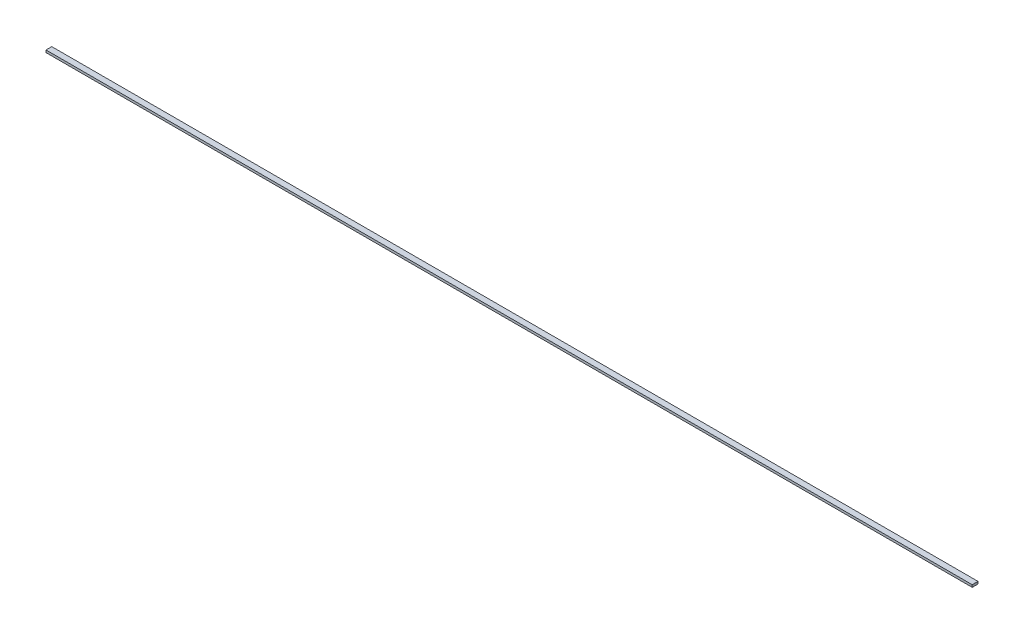
from build123d import *

# Parameters (mm, degrees)
SKETCH1_W           = 400.2
SKETCH1_H           = 1
BOSS_EXTRUDE1_DEPTH = 2.5


with BuildPart() as part:
    # Sketch1 → Boss-Extrude1 (new body)
    with BuildSketch(Plane.XY):
        Rectangle(SKETCH1_W, SKETCH1_H)
    extrude(amount=BOSS_EXTRUDE1_DEPTH)


solid = part.part
